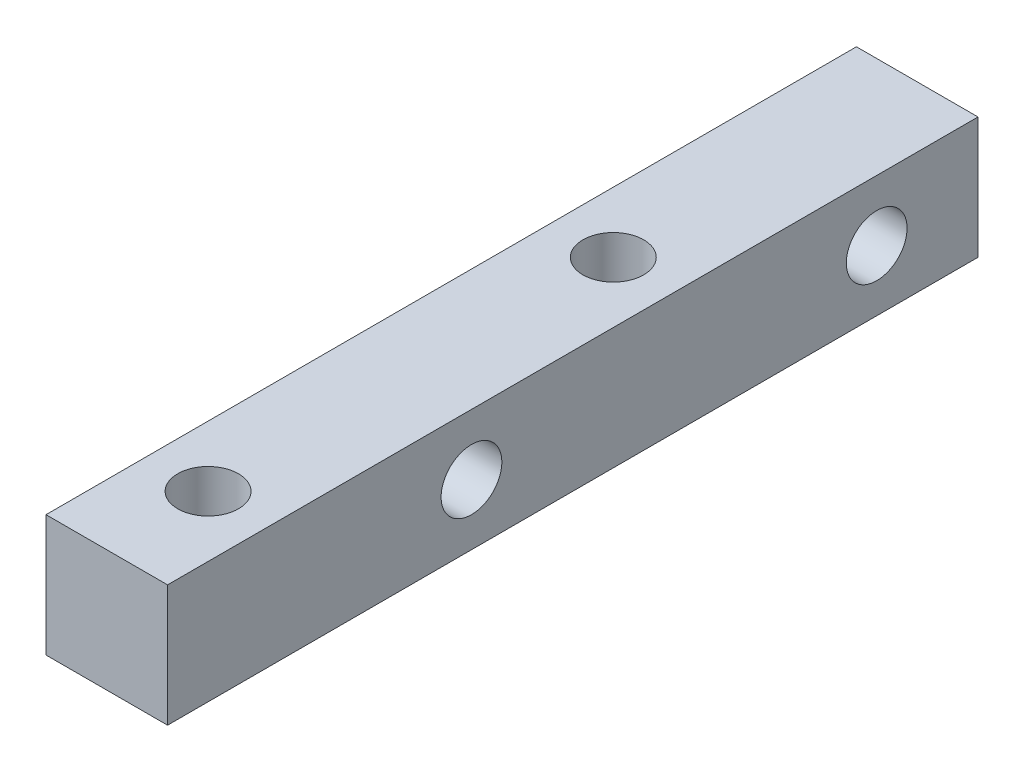
from build123d import *

# Parameters (mm, degrees)
SKETCH_1_W             = 6
SKETCH_1_H             = 6
EXTRUDE_1_DEPTH        = 40
SKETCH_2_R             = 1.5
CUT_EXTRUDE_1_DEPTH    = 41.558599581
SKETCH_3_R             = 1.5
CUT_EXTRUDE_2_DEPTH    = 41.558599581
PATTERN_LINEAR_1_COUNT = 2
PATTERN_LINEAR_1_PITCH = 20
PATTERN_LINEAR_2_COUNT = 2
PATTERN_LINEAR_2_PITCH = 20


with BuildPart() as part:
    # 草图1 → 凸台-拉伸1 (new body)
    with BuildSketch(Plane.XY):
        Rectangle(SKETCH_1_W, SKETCH_1_H)
    extrude(amount=-EXTRUDE_1_DEPTH)

    # 草图2 → 切除-拉伸1 (cut, through all)
    with BuildSketch(Plane(origin=(0, 3, 0), x_dir=(1, 0, 0), z_dir=(0, 1, 0))):
        with Locations(Location((0, 5, 0), (0, 0, 270))):
            Circle(SKETCH_2_R)
    cut_extrude_1 = extrude(amount=-CUT_EXTRUDE_1_DEPTH, mode=Mode.SUBTRACT)

    # 草图3 → 切除-拉伸2 (cut, through all)
    with BuildSketch(Plane(origin=(3, 0, 0), x_dir=(0, 0, -1), z_dir=(1, 0, 0))):
        with Locations((35, 0)):
            Circle(SKETCH_3_R)
    cut_extrude_2 = extrude(amount=-CUT_EXTRUDE_2_DEPTH, mode=Mode.SUBTRACT)

    # 阵列(线性)1: 切除-拉伸1 ×2
    with Locations(*[(0, 0, -i * PATTERN_LINEAR_1_PITCH) for i in range(1, PATTERN_LINEAR_1_COUNT)]):
        add(cut_extrude_1, mode=Mode.SUBTRACT)

    # 阵列(线性)2: 切除-拉伸2 ×2
    with Locations(*[(0, 0, i * PATTERN_LINEAR_2_PITCH) for i in range(1, PATTERN_LINEAR_2_COUNT)]):
        add(cut_extrude_2, mode=Mode.SUBTRACT)


solid = part.part
